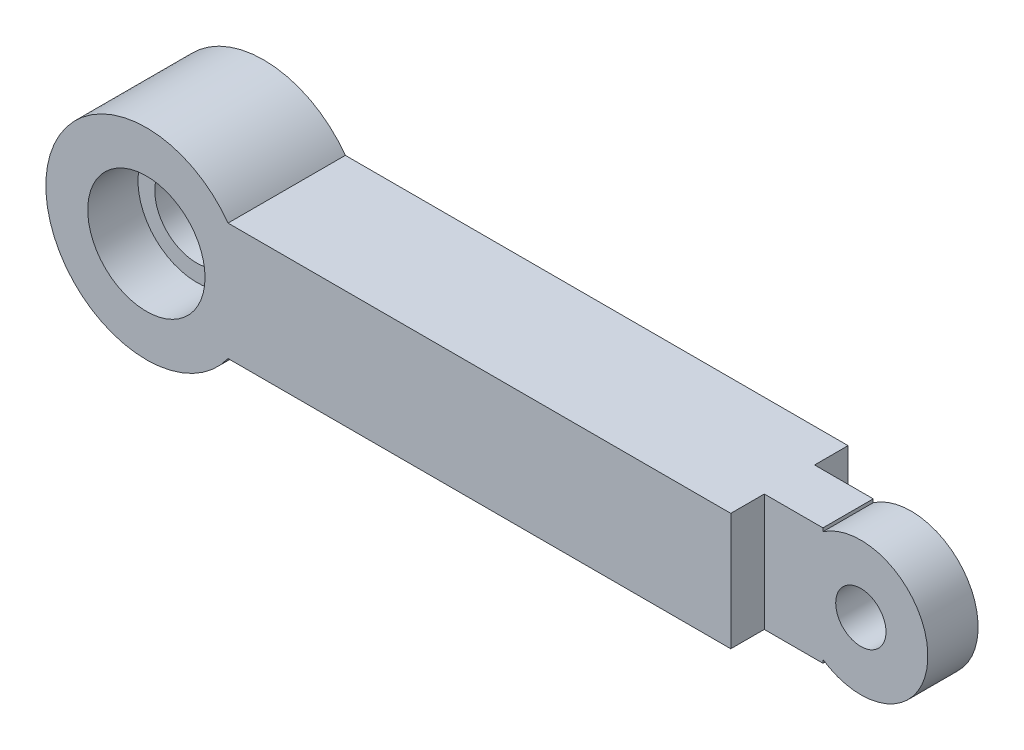
from build123d import *

# Parameters (mm, degrees)
SKETCH_1_W          = 300
SKETCH_1_H          = 70
EXTRUDE_1_DEPTH     = 70
SKETCH_2_R          = 60
EXTRUDE_2_DEPTH     = 70
SKETCH_3_W          = 35
SKETCH_3_H          = 30
EXTRUDE_3_DEPTH     = 70
SKETCH_5_R          = 40
EXTRUDE_5_DEPTH     = 30
SKETCH_6_R          = 15
CUT_EXTRUDE_1_DEPTH = 271.265181117
SKETCH_7_R          = 2
CUT_EXTRUDE_2_DEPTH = 275.669379662
SKETCH_8_R          = 25
CUT_EXTRUDE_3_DEPTH = 50
SKETCH_9_R          = 35
CUT_EXTRUDE_4_DEPTH = 30


with BuildPart() as part:
    # 草图1 → 凸台-拉伸1 (new body)
    with BuildSketch(Plane.XY):
        Rectangle(SKETCH_1_W, SKETCH_1_H)
    extrude(amount=EXTRUDE_1_DEPTH)

    # 草图2 → 凸台-拉伸2 (add)
    with BuildSketch(Plane(origin=(0, 0, 0), x_dir=(-1, 0, 0), z_dir=(0, 0, -1))):
        with Locations((198.733971724, 0)):
            Circle(SKETCH_2_R)
    extrude(amount=-EXTRUDE_2_DEPTH)

    # 草图3 → 凸台-拉伸3 (add)
    with BuildSketch(Plane(origin=(0, 35, 0), x_dir=(1, 0, 0), z_dir=(0, 1, 0))):
        with Locations((167.5, -35)):
            Rectangle(SKETCH_3_W, SKETCH_3_H)
    extrude(amount=-EXTRUDE_3_DEPTH)

    # 草图5 → 凸台-拉伸5 (add)
    with BuildSketch(Plane.XY.offset(50)):
        with Locations((207.605309111, 0)):
            Circle(SKETCH_5_R)
    extrude(amount=-EXTRUDE_5_DEPTH)

    # 草图6 → 切除-拉伸1 (cut, through all)
    with BuildSketch(Plane(origin=(0, 0, 20), x_dir=(-1, 0, 0), z_dir=(0, 0, -1))):
        with Locations((-207.605309111, 0)):
            Circle(SKETCH_6_R)
    extrude(amount=-CUT_EXTRUDE_1_DEPTH, mode=Mode.SUBTRACT)

    # 草图7 → 切除-拉伸2 (cut, through all)
    with BuildSketch(Plane(origin=(0, 0, 0), x_dir=(-1, 0, 0), z_dir=(0, 0, -1))):
        with Locations((215.983971724, 0)):
            Circle(SKETCH_7_R)
        with Locations((207.358971724, -14.938938215)):
            Circle(SKETCH_7_R)
        with Locations((190.108971724, -14.938938215)):
            Circle(SKETCH_7_R)
        with Locations((181.483971724, 0)):
            Circle(SKETCH_7_R)
        with Locations((190.108971724, 14.938938215)):
            Circle(SKETCH_7_R)
        with Locations((207.358971724, 14.938938215)):
            Circle(SKETCH_7_R)
    extrude(amount=-CUT_EXTRUDE_2_DEPTH, mode=Mode.SUBTRACT)

    # 草图8 → 切除-拉伸3 (cut)
    with BuildSketch(Plane.XY.offset(70)):
        with Locations((-198.733971724, 0)):
            Circle(SKETCH_8_R)
    extrude(amount=-CUT_EXTRUDE_3_DEPTH, mode=Mode.SUBTRACT)

    # 草图9 → 切除-拉伸4 (cut)
    with BuildSketch(Plane.XY.offset(70)):
        with Locations((-198.733971724, 0)):
            Circle(SKETCH_9_R)
    extrude(amount=-CUT_EXTRUDE_4_DEPTH, mode=Mode.SUBTRACT)


solid = part.part
